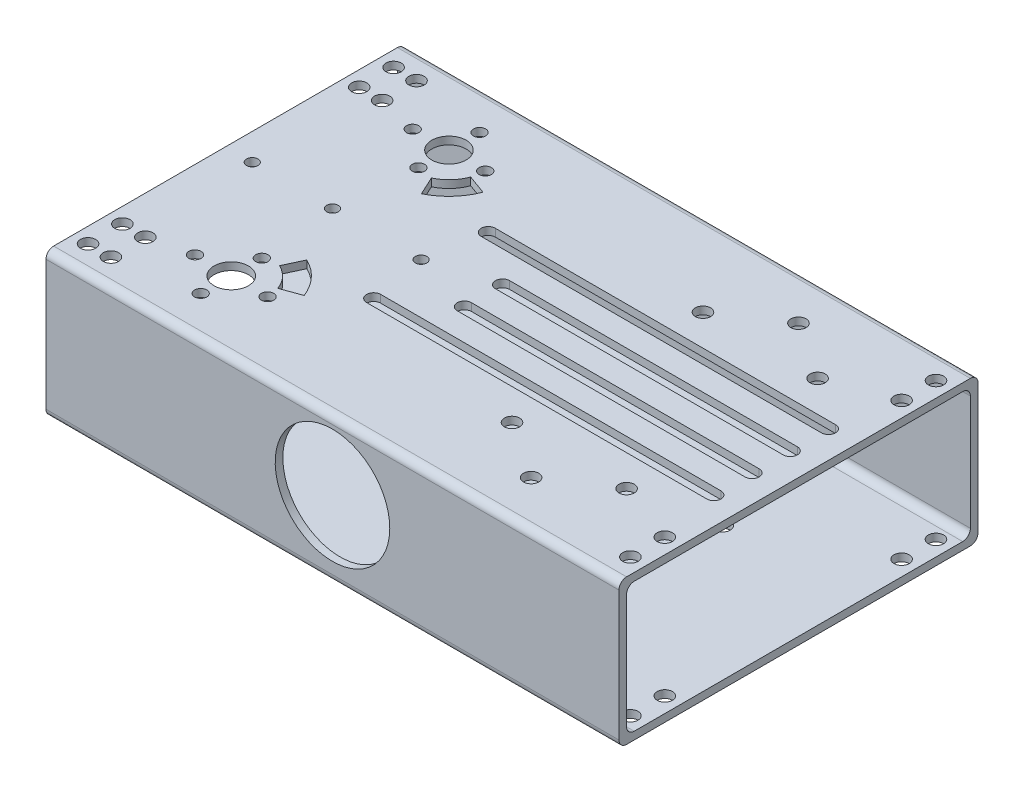
from build123d import *

# Parameters (mm, degrees)
EXTRUDE_1218_DEPTH          = 150
SKETCH_1_R                  = 1.5
SKETCH_1_R_2                = 4.5
SKETCH_1_R_3                = 1.6
CUT_EXTRUDE_1265_DEPTH      = 159.33508771
SKETCH_6_R                  = 15
CUT_EXTRUDE_1532_DEPTH      = 159.33508771
SKETCH_12_R                 = 2
CUT_EXTRUDE_1963_DEPTH      = 2
CUT_EXTRUDE_2327_DEPTH      = 162.260658685
CUT_EXTRUDE_2327_DEPTH_BACK = 162.260658685
SKETCH_14_R                 = 2
SKETCH_15_R                 = 2
CUT_EXTRUDE_2529_DEPTH      = 162.260658685


with BuildPart() as part:
    # 草图2 → Extrude 1218 (new body)
    with BuildSketch(Plane(origin=(0, 0, 0), x_dir=(0, 0, -1), z_dir=(1, 0, 0))):
        with BuildLine():
            Line((-45, 19), (45, 19))
            ThreePointArc((45, 19), (46.414213562, 18.414213562), (47, 17))
            Line((47, 17), (47, -17))
            ThreePointArc((47, -17), (46.414213562, -18.414213562), (45, -19))
            Line((45, -19), (-45, -19))
            ThreePointArc((-45, -19), (-46.414213562, -18.414213562), (-47, -17))
            Line((-47, -17), (-47, 17))
            ThreePointArc((-47, 17), (-46.414213562, 18.414213562), (-45, 19))
        make_face()
        with BuildLine():
            Line((-43, 17), (43, 17))
            ThreePointArc((43, 17), (44.414213562, 16.414213562), (45, 15))
            Line((45, 15), (45, -15))
            ThreePointArc((45, -15), (44.414213562, -16.414213562), (43, -17))
            Line((43, -17), (-43, -17))
            ThreePointArc((-43, -17), (-44.414213562, -16.414213562), (-45, -15))
            Line((-45, -15), (-45, 15))
            ThreePointArc((-45, 15), (-44.414213562, 16.414213562), (-43, 17))
        make_face(mode=Mode.SUBTRACT)
    extrude(amount=EXTRUDE_1218_DEPTH)

    # 草图1 → Cut-Extrude 1265 (cut, through all)
    with BuildSketch(Plane(origin=(0, 0, 0), x_dir=(1, 0, 0), z_dir=(0, 1, 0))):
        with Locations(Location((7, 0, 0), (0, 0, 90))):
            Circle(SKETCH_1_R)
        with Locations(Location((28, 0, 0), (0, 0, 90))):
            Circle(SKETCH_1_R)
        with Locations(Location((51.2, 0, 0), (0, 0, 90))):
            Circle(SKETCH_1_R)
        with Locations(Location((30, -28.5, 0), (0, 0, 90))):
            Circle(SKETCH_1_R_2)
        with Locations(Location((30, 28.5, 0), (0, 0, 90))):
            Circle(SKETCH_1_R_2)
        with Locations(Location((20.5, -28.5, 0), (0, 0, 90))):
            Circle(SKETCH_1_R_3)
        with Locations(Location((39.5, -28.5, 0), (0, 0, 90))):
            Circle(SKETCH_1_R_3)
        with Locations(Location((30, -36.5, 0), (0, 0, 90))):
            Circle(SKETCH_1_R_3)
        with Locations(Location((30, -20.5, 0), (0, 0, 90))):
            Circle(SKETCH_1_R_3)
        with Locations(Location((39.5, 28.5, 0), (0, 0, 90))):
            Circle(SKETCH_1_R_3)
        with Locations(Location((30, 36.5, 0), (0, 0, 90))):
            Circle(SKETCH_1_R_3)
        with Locations(Location((20.5, 28.5, 0), (0, 0, 90))):
            Circle(SKETCH_1_R_3)
        with Locations(Location((30, 20.5, 0), (0, 0, 90))):
            Circle(SKETCH_1_R_3)
        with BuildLine():
            Line((34.014873487, 19.890076023), (36.291936994, 15.006897573))
            ThreePointArc((36.291936994, 15.006897573), (40.941044845, 18.474379532), (43.990135541, 23.40800709))
            Line((43.990135541, 23.40800709), (38.927079897, 25.250808638))
            ThreePointArc((38.927079897, 25.250808638), (37.0041347, 22.081893028), (34.014873487, 19.890076023))
        make_face()
        with BuildLine():
            Line((34.014873487, -19.890076023), (36.291936994, -15.006897573))
            ThreePointArc((36.291936994, -15.006897573), (40.941044845, -18.474379532), (43.990135541, -23.40800709))
            Line((43.990135541, -23.40800709), (38.927079897, -25.250808638))
            ThreePointArc((38.927079897, -25.250808638), (37.0041347, -22.081893028), (34.014873487, -19.890076023))
        make_face()
    extrude(amount=CUT_EXTRUDE_1265_DEPTH, mode=Mode.SUBTRACT)

    # 草图6 → Cut-Extrude 1532 (cut, through all)
    with BuildSketch(Plane.XY):
        with Locations(Location((75, 1, 0), (0, 0, 111.039469781))):
            Circle(SKETCH_6_R)
    extrude(amount=CUT_EXTRUDE_1532_DEPTH, mode=Mode.SUBTRACT)

    # 草图12 → Cut-Extrude 1963 (cut)
    with BuildSketch(Plane(origin=(0, 19, 0), x_dir=(1, 0, 0), z_dir=(0, 1, 0))):
        with Locations(Location((100, 25, 0), (0, 0, 270))):
            Circle(SKETCH_12_R)
        with Locations(Location((130, 25, 0), (0, 0, 270))):
            Circle(SKETCH_12_R)
        with Locations(Location((115, 35, 0), (0, 0, 270))):
            Circle(SKETCH_12_R)
        with Locations(Location((115, -35, 0), (0, 0, 90))):
            Circle(SKETCH_12_R)
        with Locations(Location((130, -25, 0), (0, 0, 90))):
            Circle(SKETCH_12_R)
        with Locations(Location((100, -25, 0), (0, 0, 90))):
            Circle(SKETCH_12_R)
        with BuildLine():
            Line((53.777197841, 16.849529373), (142.85706065, 16.849529373))
            ThreePointArc((142.85706065, 16.849529373), (144.706590023, 15), (142.85706065, 13.150470627))
            Line((142.85706065, 13.150470627), (53.777197841, 13.150470627))
            ThreePointArc((53.777197841, 13.150470627), (51.927668468, 15), (53.777197841, 16.849529373))
        make_face()
        with BuildLine():
            Line((67.529255568, 6.850912176), (142.85706065, 6.850912176))
            ThreePointArc((142.85706065, 6.850912176), (144.707972825, 5), (142.85706065, 3.149087824))
            Line((142.85706065, 3.149087824), (67.529255568, 3.149087824))
            ThreePointArc((67.529255568, 3.149087824), (65.678343393, 5), (67.529255568, 6.850912176))
        make_face()
        with BuildLine():
            Line((53.777197841, -16.849529373), (142.85706065, -16.849529373))
            ThreePointArc((142.85706065, -16.849529373), (144.706590023, -15), (142.85706065, -13.150470627))
            Line((142.85706065, -13.150470627), (53.777197841, -13.150470627))
            ThreePointArc((53.777197841, -13.150470627), (51.927668468, -15), (53.777197841, -16.849529373))
        make_face()
        with BuildLine():
            Line((67.529255568, -6.850912176), (142.85706065, -6.850912176))
            ThreePointArc((142.85706065, -6.850912176), (144.707972825, -5), (142.85706065, -3.149087824))
            Line((142.85706065, -3.149087824), (67.529255568, -3.149087824))
            ThreePointArc((67.529255568, -3.149087824), (65.678343393, -5), (67.529255568, -6.850912176))
        make_face()
    extrude(amount=-CUT_EXTRUDE_1963_DEPTH, mode=Mode.SUBTRACT)

    # 草图14 → Cut-Extrude 2327 (cut, two sides: drawn at the far end of the back side and taken through both)
    with BuildSketch(Plane(origin=(0, -17, 0), x_dir=(1, 0, 0), z_dir=(0, 1, 0)).offset(-CUT_EXTRUDE_2327_DEPTH_BACK)):
        with Locations(Location((4, 40, 0), (0, 0, 270))):
            Circle(SKETCH_14_R)
        with Locations(Location((4, 31, 0), (0, 0, 270))):
            Circle(SKETCH_14_R)
        with Locations(Location((4, -31, 0), (0, 0, 90))):
            Circle(SKETCH_14_R)
        with Locations(Location((4, -40, 0), (0, 0, 90))):
            Circle(SKETCH_14_R)
        with Locations(Location((146, 40, 0), (0, 0, 270))):
            Circle(SKETCH_14_R)
        with Locations(Location((146, 31, 0), (0, 0, 270))):
            Circle(SKETCH_14_R)
        with Locations(Location((146, -40, 0), (0, 0, 90))):
            Circle(SKETCH_14_R)
        with Locations(Location((146, -31, 0), (0, 0, 90))):
            Circle(SKETCH_14_R)
        with Locations(Location((10, 40, 0), (0, 0, 270))):
            Circle(SKETCH_14_R)
        with Locations(Location((10, 31, 0), (0, 0, 270))):
            Circle(SKETCH_14_R)
        with Locations(Location((10, -40, 0), (0, 0, 90))):
            Circle(SKETCH_14_R)
        with Locations(Location((10, -31, 0), (0, 0, 90))):
            Circle(SKETCH_14_R)
    extrude(amount=CUT_EXTRUDE_2327_DEPTH + CUT_EXTRUDE_2327_DEPTH_BACK, mode=Mode.SUBTRACT)

    # 草图15 → Cut-Extrude 2529 (cut, through all)
    with BuildSketch(Plane(origin=(0, -17, 0), x_dir=(1, 0, 0), z_dir=(0, 1, 0))):
        with Locations(Location((57, 15.150470627, 0), (0, 0, 270))):
            Circle(SKETCH_15_R)
        with Locations(Location((57, -15.150470627, 0), (0, 0, 270))):
            Circle(SKETCH_15_R)
        with Locations(Location((115, 15.150470627, 0), (0, 0, 270))):
            Circle(SKETCH_15_R)
        with Locations(Location((115, -15.150470627, 0), (0, 0, 270))):
            Circle(SKETCH_15_R)
    extrude(amount=-CUT_EXTRUDE_2529_DEPTH, mode=Mode.SUBTRACT)


solid = part.part
